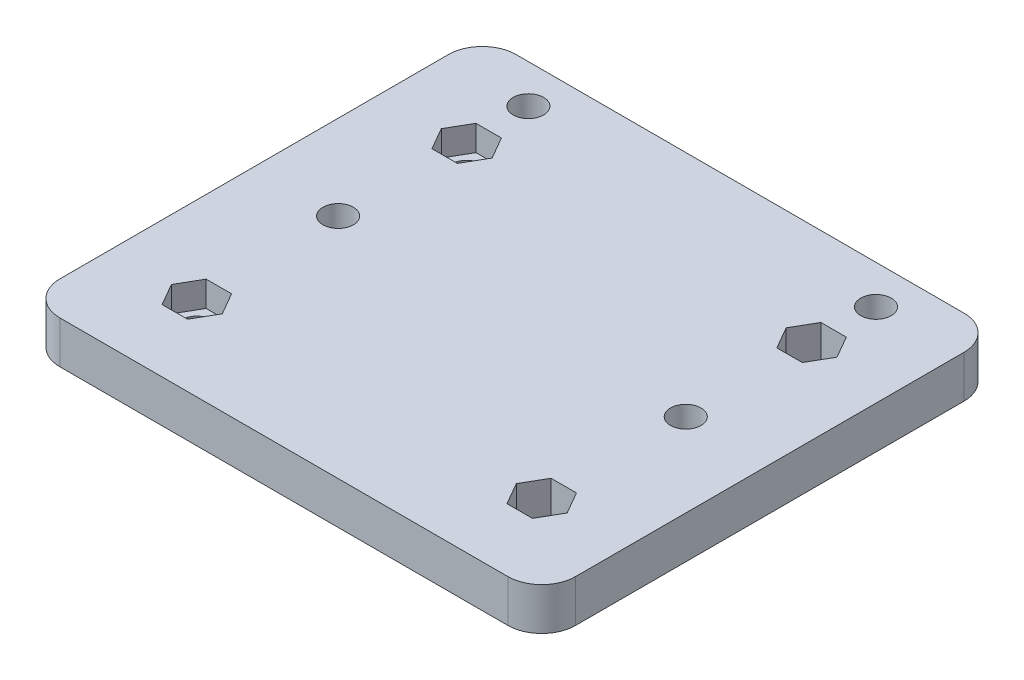
from build123d import *

# Parameters (mm, degrees)
SKETCH1_W            = 152.20001
SKETCH1_H            = 134.65
BOSS_EXTRUDE1_DEPTH  = 12.5
M8_CLEARANCE_HOLE1_D = 9
M8_CLEARANCE_HOLE2_D = 9
FILLET1_R            = 10
CUT_EXTRUDE1_DEPTH   = 10.5
CUT_EXTRUDE2_DEPTH   = 7.5
CUT_EXTRUDE3_START   = -12.5
CUT_EXTRUDE3_DEPTH   = 6


with BuildPart() as part:
    # Sketch1 → Boss-Extrude1 (new body)
    with BuildSketch(Plane(origin=(0, 0, 0), x_dir=(1, 0, 0), z_dir=(0, 1, 0))):
        with Locations((50.699995, 42.325)):
            Rectangle(SKETCH1_W, SKETCH1_H)
    extrude(amount=BOSS_EXTRUDE1_DEPTH)

    # M8 Clearance Hole1 (through all)
    with Locations(Plane(origin=(0, 0, 0), x_dir=(-1, 0, 0), z_dir=(0, -1, 0))):
        with Locations((-102.19999, 42.11), (0.40001, 42.11), (0.40001, 98.26), (-102.19999, 98.26)):
            Hole(M8_CLEARANCE_HOLE1_D / 2)

    # M8 Clearance Hole2 (through all)
    with Locations(Plane(origin=(0, 0, 0), x_dir=(-1, 0, 0), z_dir=(0, -1, 0))):
        with Locations((-101.8, 0), (0, 0), (-101.8, 79.65), (0, 79.65)):
            Hole(M8_CLEARANCE_HOLE2_D / 2)

    # Fillet1
    fillet1_edges = [part.edges().sort_by_distance(p)[0] for p in [
        (-25.40001, 6.25, -109.65),
        (126.8, 6.25, -109.65),
        (126.8, 6.25, 25),
        (-25.40001, 6.25, 25),
    ]]
    fillet(fillet1_edges, radius=FILLET1_R)

    # Sketch12 → Cut-Extrude1 (cut)
    with BuildSketch(Plane(origin=(0, 12.5, 0), x_dir=(1, 0, 0), z_dir=(0, 1, 0))):
        Polygon((94.294446501, 79.65), (98.04722325, 73.15), (105.55277675, 73.15), (109.305553499, 79.65), (105.55277675, 86.15), (98.04722325, 86.15), align=None)
        Polygon((94.294446501, 0), (98.04722325, -6.5), (105.55277675, -6.5), (109.305553499, 0), (105.55277675, 6.5), (98.04722325, 6.5), align=None)
    extrude(amount=-CUT_EXTRUDE1_DEPTH, mode=Mode.SUBTRACT)

    # Sketch12<4> → Cut-Extrude2 (cut)
    with BuildSketch(Plane(origin=(0, 12.5, 0), x_dir=(1, 0, 0), z_dir=(0, 1, 0))):
        Polygon((7.505553499, 79.65), (3.75277675, 86.15), (-3.75277675, 86.15), (-7.505553499, 79.65), (-3.75277675, 73.15), (3.75277675, 73.15), align=None)
        Polygon((7.505553499, 0), (3.75277675, 6.5), (-3.75277675, 6.5), (-7.505553499, 0), (-3.75277675, -6.5), (3.75277675, -6.5), align=None)
    extrude(amount=-CUT_EXTRUDE2_DEPTH, mode=Mode.SUBTRACT)

    # Sketch12<5> → Cut-Extrude3 (cut)
    with BuildSketch(Plane(origin=(0, 12.5, 0), x_dir=(1, 0, 0), z_dir=(0, 1, 0)).offset(CUT_EXTRUDE3_START)):
        Polygon((7.105543499, 98.26), (3.35276675, 104.76), (-4.15278675, 104.76), (-7.905563499, 98.26), (-4.15278675, 91.76), (3.35276675, 91.76), align=None)
        Polygon((109.705543499, 98.26), (105.95276675, 104.76), (98.44721325, 104.76), (94.694436501, 98.26), (98.44721325, 91.76), (105.95276675, 91.76), align=None)
        Polygon((7.105543499, 42.11), (3.35276675, 48.61), (-4.15278675, 48.61), (-7.905563499, 42.11), (-4.15278675, 35.61), (3.35276675, 35.61), align=None)
        Polygon((109.705543499, 42.11), (105.95276675, 48.61), (98.44721325, 48.61), (94.694436501, 42.11), (98.44721325, 35.61), (105.95276675, 35.61), align=None)
    extrude(amount=CUT_EXTRUDE3_DEPTH, mode=Mode.SUBTRACT)


solid = part.part
